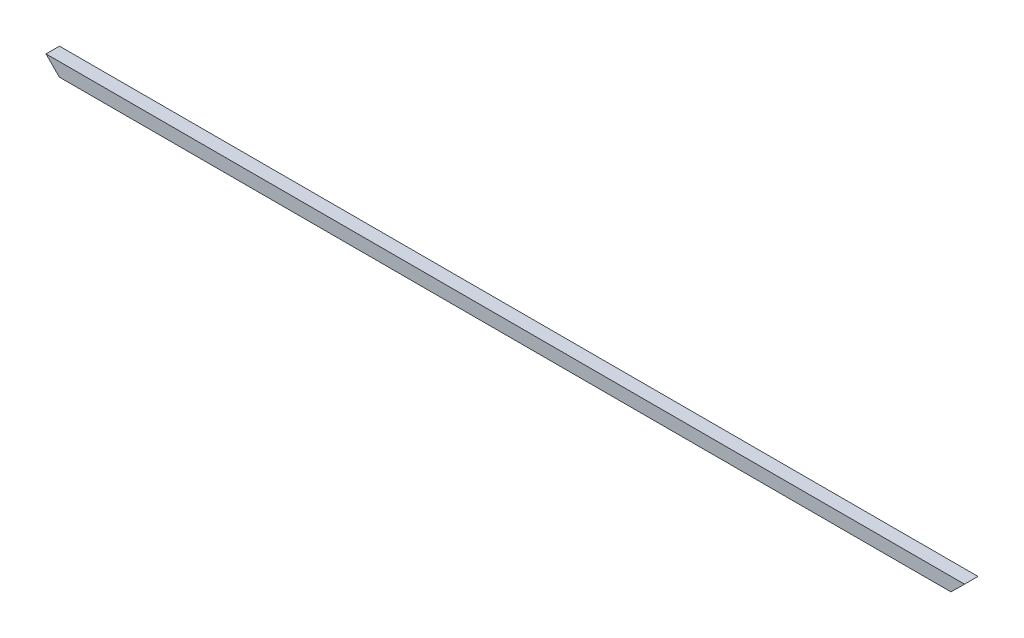
from build123d import *

# Parameters (mm, degrees)
BOSS_EXTRUDE1_DEPTH = 40


with BuildPart() as part:
    # Sketch2 → Boss-Extrude1 (new body)
    with BuildSketch(Plane.XY):
        Polygon((-2705.82074398, 0), (23.64925602, 0), (-16.771831658, -40), (-2666.237444967, -40), align=None)
    extrude(amount=BOSS_EXTRUDE1_DEPTH)


solid = part.part
